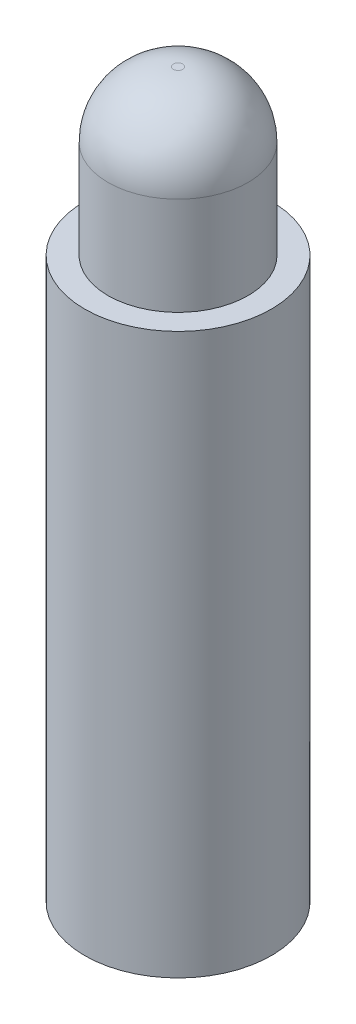
from build123d import *

# Parameters (mm, degrees)
SKETCH1_R           = 2
BOSS_EXTRUDE1_DEPTH = 12
SKETCH2_R           = 1.5
BOSS_EXTRUDE2_DEPTH = 3.5
FILLET1_R           = 1.4


with BuildPart() as part:
    # Sketch1 → Boss-Extrude1 (new body)
    with BuildSketch(Plane(origin=(0, 0, 0), x_dir=(1, 0, 0), z_dir=(0, 1, 0))):
        with Locations(Location((0, 0, 0), (0, 0, 270))):
            Circle(SKETCH1_R)
    extrude(amount=BOSS_EXTRUDE1_DEPTH)

    # Sketch2 → Boss-Extrude2 (add)
    with BuildSketch(Plane(origin=(0, 12, 0), x_dir=(1, 0, 0), z_dir=(0, 1, 0))):
        with Locations(Location((0, 0, 0), (0, 0, 270))):
            Circle(SKETCH2_R)
    extrude(amount=BOSS_EXTRUDE2_DEPTH)

    # Fillet1
    fillet1_edges = [part.edges().sort_by_distance(p)[0] for p in [
        (0, 15.5, -1.5),
    ]]
    fillet(fillet1_edges, radius=FILLET1_R)


solid = part.part
